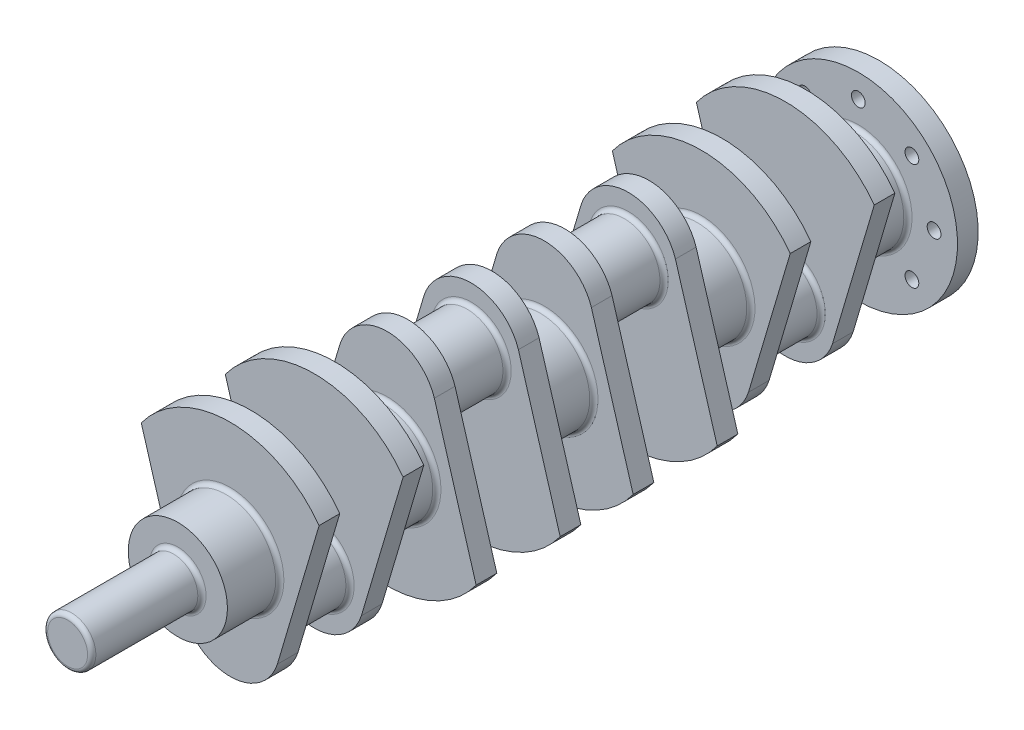
from build123d import *

# Parameters (mm, degrees)
BOSS_EXTRUDE3_DEPTH   = 15
SKETCH5_R             = 26
BOSS_EXTRUDE4_DEPTH   = 46
SKETCH6_R             = 36
BOSS_EXTRUDE5_DEPTH   = 38
BODY_MOVE_COPY1_ANGLE = 180
SKETCH7_R             = 17.5
BOSS_EXTRUDE6_DEPTH   = 80
SKETCH8_R             = 72
SKETCH8_R_2           = 5
BOSS_EXTRUDE7_DEPTH   = 15
FILLET2_R             = 3


with BuildPart() as part:
    # Sketch1 → Boss-Extrude3 (new body)
    with BuildSketch(Plane.XY):
        with BuildLine():
            ThreePointArc((64.560355465, 12.906031471), (0, 45.662402247), (-64.560355465, 12.906031471))
            Line((-64.560355465, 12.906031471), (-34.778331639, -87.636395976))
            ThreePointArc((-34.778331639, -87.636395976), (-4.689352887, -42.644321502), (36, -78.337597753))
            ThreePointArc((36, -78.337597753), (35.693276251, -83.026950639), (34.778331639, -87.636395976))
            Line((34.778331639, -87.636395976), (64.560355465, 12.906031471))
        make_face()
        with BuildLine():
            ThreePointArc((36, -78.337597753), (-4.689352887, -42.644321502), (-34.778331639, -87.636395976))
            Line((-34.778331639, -87.636395976), (-34.232051639, -89.480606349))
            ThreePointArc((-34.232051639, -89.480606349), (0, -114.337597753), (34.232051639, -89.480606349))
            Line((34.232051639, -89.480606349), (34.778331639, -87.636395976))
            ThreePointArc((34.778331639, -87.636395976), (35.693276251, -83.026950639), (36, -78.337597753))
        make_face()
    boss_extrude3 = extrude(amount=BOSS_EXTRUDE3_DEPTH)

    # Sketch5 → Boss-Extrude4 (add)
    with BuildSketch(Plane(origin=(0, 0, 0), x_dir=(-1, 0, 0), z_dir=(0, 0, -1))):
        with Locations((0, -73.336475423)):
            Circle(SKETCH5_R)
    extrude(amount=BOSS_EXTRUDE4_DEPTH)

    # Sketch6 → Boss-Extrude5 (add)
    with BuildSketch(Plane.XY.offset(15)):
        with Locations((0, -34.337597753)):
            Circle(SKETCH6_R)
    boss_extrude5 = extrude(amount=BOSS_EXTRUDE5_DEPTH)

    # Mirror8: Boss-Extrude3, Boss-Extrude5 across plane
    add(boss_extrude3.mirror(Plane(origin=(0, 0, -23), x_dir=(1, 0, 0), z_dir=(0, 0, -1))))
    add(boss_extrude5.mirror(Plane(origin=(0, 0, -23), x_dir=(1, 0, 0), z_dir=(0, 0, -1))))


with BuildPart() as body_2:
    # Mirror10: mirrored copy
    add(part.part.mirror(Plane(origin=(0, 0, -80), x_dir=(1, 0, 0), z_dir=(0, 0, -1))))


with BuildPart() as body_2_1:
    # Body-Move/Copy1: moved
    add(body_2.part.rotate(Axis((0, -34.337597753, -137), (1, 0, 0)), BODY_MOVE_COPY1_ANGLE))


with BuildPart() as body_3:
    # Mirror11: mirrored copy
    add(body_2_1.part.mirror(Plane(origin=(0, 0, -194), x_dir=(1, 0, 0), z_dir=(0, 0, -1))))


with BuildPart() as body_4:
    # Mirror11 2: mirrored copy
    add(part.part.mirror(Plane(origin=(0, 0, -194), x_dir=(1, 0, 0), z_dir=(0, 0, -1))))

    # Sketch8 → Boss-Extrude7 (add)
    with BuildSketch(Plane(origin=(0, 0, -441), x_dir=(-1, 0, 0), z_dir=(0, 0, -1))):
        with Locations(Location((0, -34.337597753, 0), (0, 0, 90))):
            Circle(SKETCH8_R)
        with Locations(Location((0, 20.662402247, 0), (0, 0, 90))):
            Circle(SKETCH8_R_2, mode=Mode.SUBTRACT)
        with Locations(Location((38.890872965, 4.553275213, 0), (0, 0, 90))):
            Circle(SKETCH8_R_2, mode=Mode.SUBTRACT)
        with Locations(Location((55, -34.337597753, 0), (0, 0, 90))):
            Circle(SKETCH8_R_2, mode=Mode.SUBTRACT)
        with Locations(Location((38.890872965, -73.228470718, 0), (0, 0, 90))):
            Circle(SKETCH8_R_2, mode=Mode.SUBTRACT)
        with Locations(Location((0, -89.337597753, 0), (0, 0, 90))):
            Circle(SKETCH8_R_2, mode=Mode.SUBTRACT)
        with Locations(Location((-38.890872965, -73.228470718, 0), (0, 0, 90))):
            Circle(SKETCH8_R_2, mode=Mode.SUBTRACT)
        with Locations(Location((-55, -34.337597753, 0), (0, 0, 90))):
            Circle(SKETCH8_R_2, mode=Mode.SUBTRACT)
        with Locations(Location((-38.890872965, 4.553275213, 0), (0, 0, 90))):
            Circle(SKETCH8_R_2, mode=Mode.SUBTRACT)
    extrude(amount=BOSS_EXTRUDE7_DEPTH)


with BuildPart() as part_1:
    add(part.part)

    # Sketch7 → Boss-Extrude6 (add)
    with BuildSketch(Plane.XY.offset(53)):
        with Locations((0, -34.337597753)):
            Circle(SKETCH7_R)
    extrude(amount=BOSS_EXTRUDE6_DEPTH)

    # Combine1: union body 2, body 3, body 4
    add(body_2_1.part)
    add(body_3.part)
    add(body_4.part)

    # Fillet2
    fillet2_edges = [part_1.edges().sort_by_distance(p)[0] for p in [
        (26, -73.336475423, 0),
        (26, -73.336475423, -46),
        (-36, -34.337597753, 15),
        (-36, -34.337597753, -61),
        (-17.5, -34.337597753, 53),
        (-17.5, -34.337597753, 133),
        (-36, -34.337597753, -99),
        (26, 4.661279918, -114),
        (26, 4.661279918, -160),
        (-36, -34.337597753, -175),
        (26, 4.661279918, -274),
        (-36, -34.337597753, -289),
        (-36, -34.337597753, -213),
        (26, 4.661279918, -228),
        (-36, -34.337597753, -403),
        (26, -73.336475423, -388),
        (26, -73.336475423, -342),
        (-36, -34.337597753, -441),
        (-36, -34.337597753, -327),
    ]]
    fillet(fillet2_edges, radius=FILLET2_R)


solid = part_1.part
